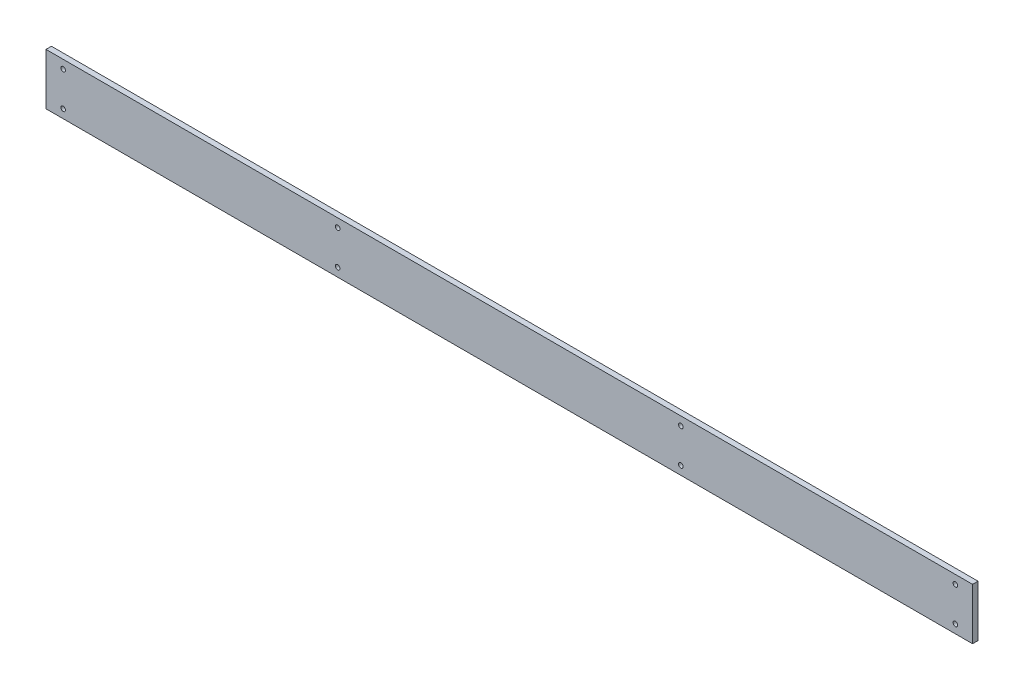
from build123d import *

# Parameters (mm, degrees)
SKETCH3_W               = 540
SKETCH3_H               = 30
BOSS_EXTRUDE3_DEPTH     = 3.18
CUT_EXTRUDE1_REACH      = 272.435
SKETCH4_R               = 1.35
MIRROR2_COPY_1_REACH    = 272.435
MIRROR2_COPY_1_SKETCH_R = 1.35
CUT_EXTRUDE2_REACH      = 272.435
SKETCH5_R               = 1.35
MIRROR4_COPY_1_REACH    = 272.435
MIRROR4_COPY_1_SKETCH_R = 1.35


with BuildPart() as part:
    # Sketch3 → Boss-Extrude3 (new body)
    with BuildSketch(Plane.XY):
        Rectangle(SKETCH3_W, SKETCH3_H)
    extrude(amount=BOSS_EXTRUDE3_DEPTH)

    # Sketch4 → Cut-Extrude1 (cut, up to next)
    with BuildSketch(Plane.XY.offset(3.18), mode=Mode.PRIVATE) as cut_extrude1_sk1:
        with Locations((260, 10)):
            Circle(SKETCH4_R)
    cut_extrude1_tool1 = extrude(cut_extrude1_sk1.sketch, amount=-CUT_EXTRUDE1_REACH, mode=Mode.PRIVATE) & part.part
    cut_extrude1 = cut_extrude1_tool1.solids().sort_by_distance((260, 10, 3.18))[0]
    add(cut_extrude1, mode=Mode.SUBTRACT)

    # Mirror1: Cut-Extrude1 across plane
    add(cut_extrude1.mirror(Plane.ZX), mode=Mode.SUBTRACT)

    # Mirror2: Cut-Extrude1 across plane
    add(cut_extrude1.mirror(Plane(origin=(0, 0, 0), x_dir=(0, 0, 1), z_dir=(1, 0, 0))), mode=Mode.SUBTRACT)

    # Mirror2 copy 1 sketch → Mirror2 copy 1 (cut, up to next)
    with BuildSketch(Plane(origin=(0, 0, 3.18), x_dir=(-1, 0, 0), z_dir=(0, 0, 1)), mode=Mode.PRIVATE) as mirror2_copy_1_sk1:
        with Locations((260, 10)):
            Circle(MIRROR2_COPY_1_SKETCH_R)
    mirror2_copy_1_tool1 = extrude(mirror2_copy_1_sk1.sketch, amount=-MIRROR2_COPY_1_REACH, mode=Mode.PRIVATE) & part.part
    add(mirror2_copy_1_tool1.solids().sort_by_distance((-260, -10, 3.18))[0], mode=Mode.SUBTRACT)

    # Sketch5 → Cut-Extrude2 (cut, up to next)
    with BuildSketch(Plane.XY.offset(3.18), mode=Mode.PRIVATE) as cut_extrude2_sk1:
        with Locations((100, -10)):
            Circle(SKETCH5_R)
    cut_extrude2_tool1 = extrude(cut_extrude2_sk1.sketch, amount=-CUT_EXTRUDE2_REACH, mode=Mode.PRIVATE) & part.part
    cut_extrude2 = cut_extrude2_tool1.solids().sort_by_distance((100, -10, 3.18))[0]
    add(cut_extrude2, mode=Mode.SUBTRACT)

    # Mirror3: Cut-Extrude2 across plane
    add(cut_extrude2.mirror(Plane(origin=(0, 0, 0), x_dir=(0, 0, 1), z_dir=(1, 0, 0))), mode=Mode.SUBTRACT)

    # Mirror4: Cut-Extrude2 across plane
    add(cut_extrude2.mirror(Plane.ZX), mode=Mode.SUBTRACT)

    # Mirror4 copy 1 sketch → Mirror4 copy 1 (cut, up to next)
    with BuildSketch(Plane(origin=(0, 0, 3.18), x_dir=(-1, 0, 0), z_dir=(0, 0, 1)), mode=Mode.PRIVATE) as mirror4_copy_1_sk1:
        with Locations((100, -10)):
            Circle(MIRROR4_COPY_1_SKETCH_R)
    mirror4_copy_1_tool1 = extrude(mirror4_copy_1_sk1.sketch, amount=-MIRROR4_COPY_1_REACH, mode=Mode.PRIVATE) & part.part
    add(mirror4_copy_1_tool1.solids().sort_by_distance((-100, 10, 3.18))[0], mode=Mode.SUBTRACT)


solid = part.part
